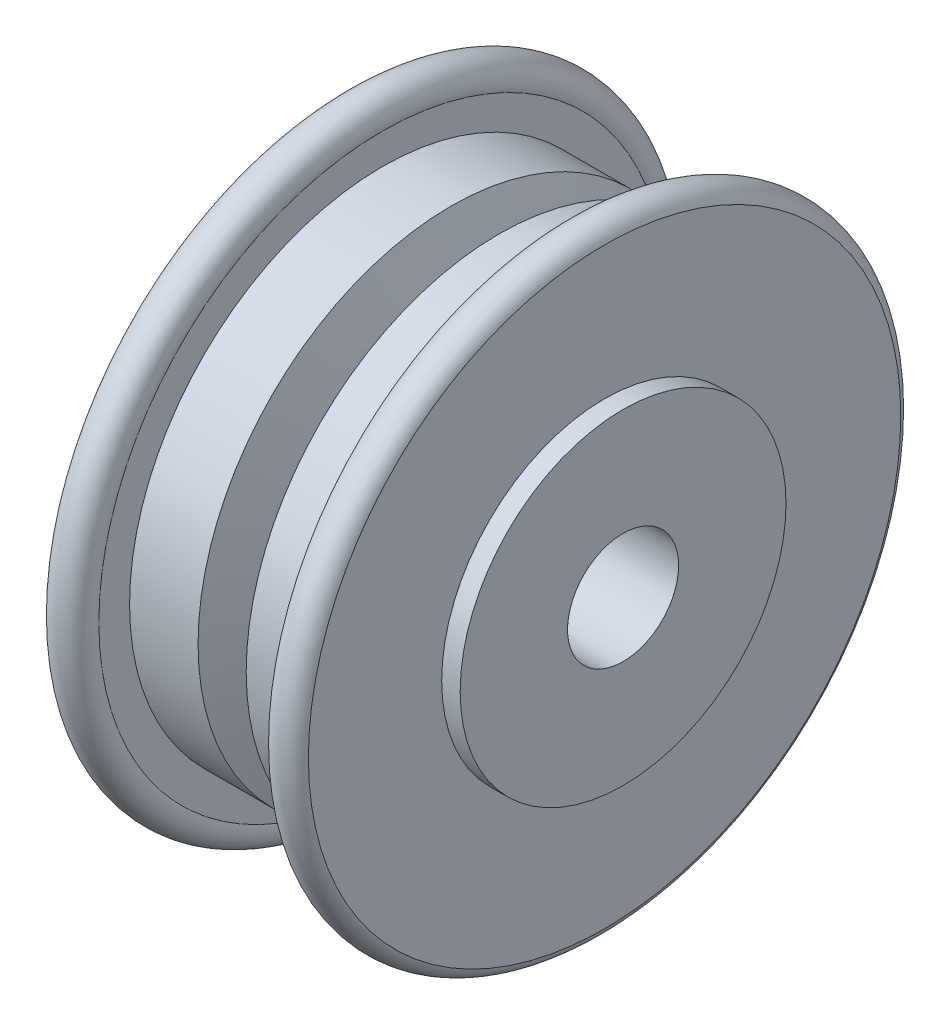
from build123d import *

# Parameters (mm, degrees)
SKETCH1_W          = 10
SKETCH1_H          = 88
SKETCH1_W_2        = 37
SKETCH1_H_2        = 136.59637726
SKETCH2_R          = 30
CUT_EXTRUDE1_DEPTH = 500


with BuildPart() as part:
    # Sketch1 → Revolve9 (revolve)
    with BuildSketch(Plane.XY, mode=Mode.PRIVATE) as revolve9_sk:
        with Locations((-150, 44)):
            Rectangle(SKETCH1_W, SKETCH1_H)
        with BuildLine():
            Line((-145, 0), (-125, 0))
            Line((-125, 0), (-125, 136.59637726))
            Line((-125, 136.59637726), (-125, 153.19275452))
            ThreePointArc((-125, 153.19275452), (-131.59637726, 166.59637726), (-145, 160))
            Line((-145, 160), (-145, 88))
            Line((-145, 88), (-145, 0))
        make_face()
        with Locations((-106.5, 68.29818863)):
            Rectangle(SKETCH1_W_2, SKETCH1_H_2)
        Polygon((-62, 0), (-62, 136.59637726), (-75, 98.275266021), (-88, 136.59637726), (-88, 0), align=None)
        with Locations((-43.5, 68.29818863)):
            Rectangle(SKETCH1_W_2, SKETCH1_H_2)
        with BuildLine():
            Line((-5, 88), (-5, 160))
            ThreePointArc((-5, 160), (-18.40362274, 166.59637726), (-25, 153.19275452))
            Line((-25, 153.19275452), (-25, 136.59637726))
            Line((-25, 136.59637726), (-25, 0))
            Line((-25, 0), (-5, 0))
            Line((-5, 0), (-5, 88))
        make_face()
        with Locations((0, 44)):
            Rectangle(SKETCH1_W, SKETCH1_H)
    revolve(revolve9_sk.sketch.rotate(Axis((0, 0, 0), (1, 0, 0)), 90), axis=Axis((0, 0, 0), (1, 0, 0)))

    # Sketch2 → Cut-Extrude1 (cut)
    with BuildSketch(Plane(origin=(5, 0, 0), x_dir=(0, 0, -1), z_dir=(1, 0, 0))):
        Circle(SKETCH2_R)
    extrude(amount=-CUT_EXTRUDE1_DEPTH, mode=Mode.SUBTRACT)


solid = part.part
